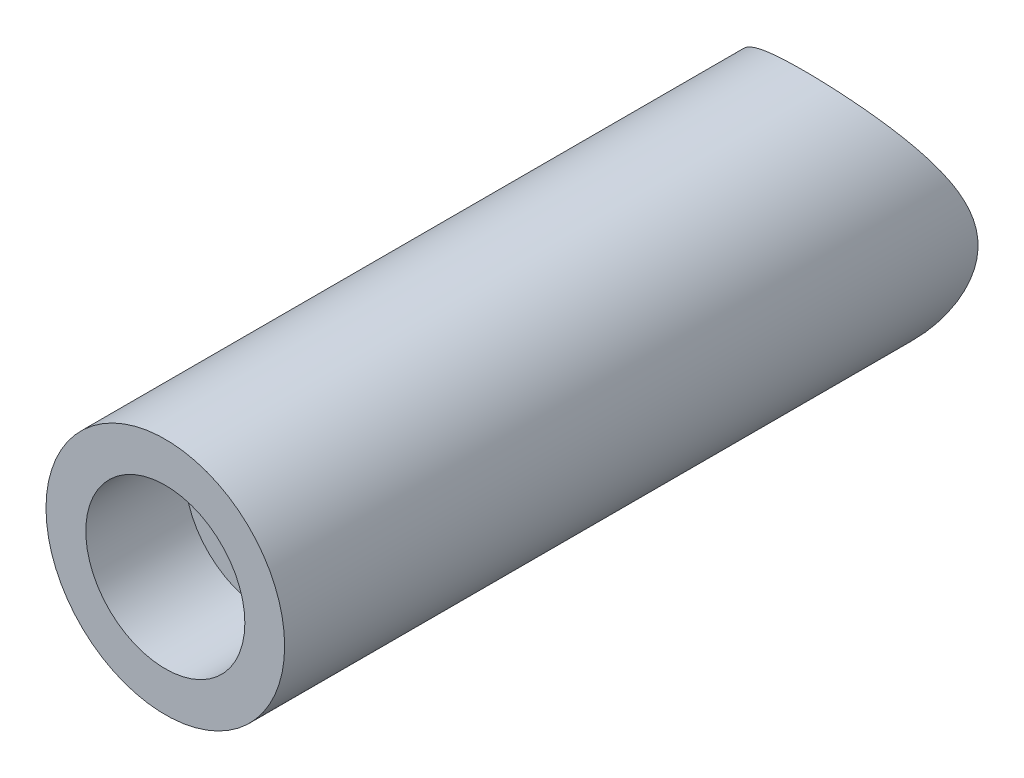
from build123d import *

# Parameters (mm, degrees)
SKETCH1_R               = 114.3
BOSS_EXTRUDE1_DEPTH     = 762
SKETCH2_R               = 76.2
CUT_EXTRUDE1_DEPTH      = 94.996
CUT_EXTRUDE2_DEPTH      = 241.046
CUT_EXTRUDE2_DEPTH_BACK = 276.352
SKETCH6_R               = 150.368


with BuildPart() as part:
    # Sketch1 → Boss-Extrude1 (new body)
    with BuildSketch(Plane.XY):
        Circle(SKETCH1_R)
    extrude(amount=BOSS_EXTRUDE1_DEPTH)

    # Sketch2 → Cut-Extrude1 (cut)
    with BuildSketch(Plane.XY.offset(762)):
        Circle(SKETCH2_R)
    extrude(amount=-CUT_EXTRUDE1_DEPTH, mode=Mode.SUBTRACT)

    # Sketch6 → Cut-Extrude2 (cut, two sides: drawn at the far end of the back side and taken through both)
    with BuildSketch(Plane(origin=(0, 0, 0), x_dir=(1, 0, 0), z_dir=(0, 1, 0)).offset(-CUT_EXTRUDE2_DEPTH_BACK)):
        Circle(SKETCH6_R)
    extrude(amount=CUT_EXTRUDE2_DEPTH + CUT_EXTRUDE2_DEPTH_BACK, mode=Mode.SUBTRACT)


solid = part.part
